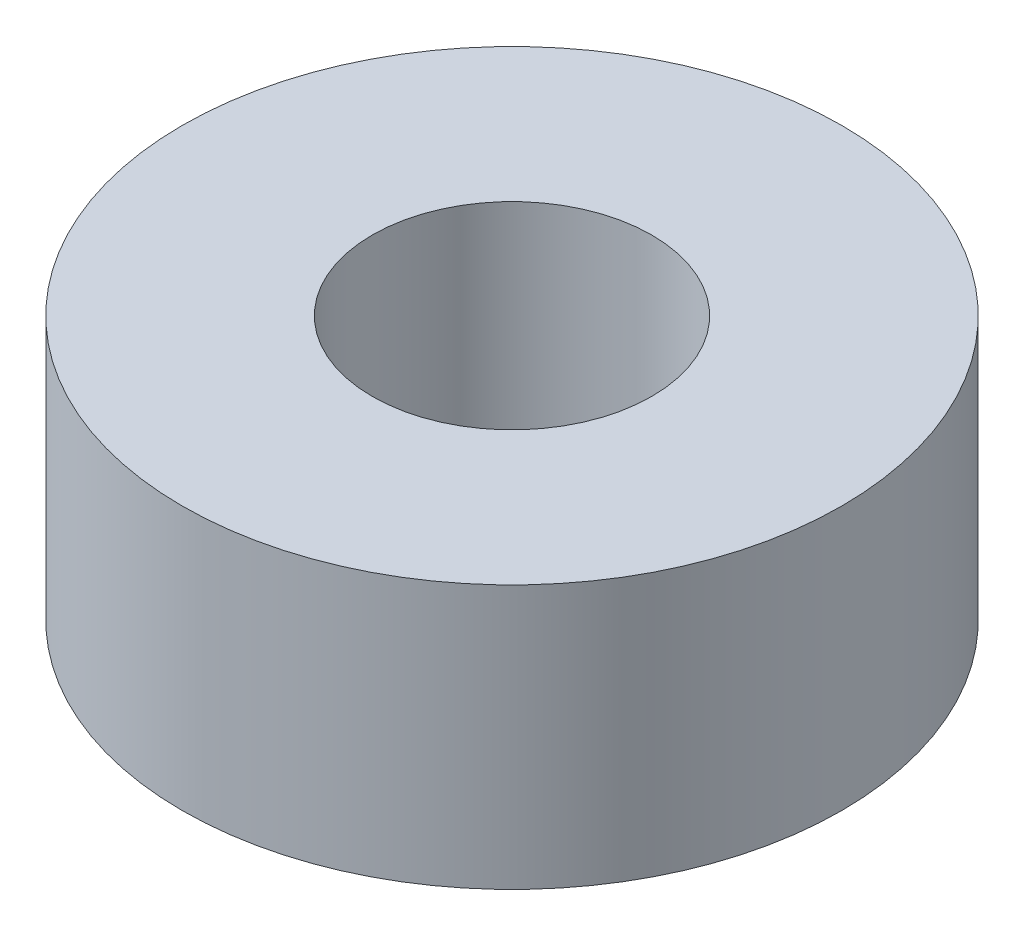
from build123d import *

# Parameters (mm, degrees)
SKETCH1_R           = 7.9375
SKETCH1_R_2         = 3.3655
BOSS_EXTRUDE1_DEPTH = 6.35


with BuildPart() as part:
    # Sketch1 → Boss-Extrude1 (new body)
    with BuildSketch(Plane(origin=(0, 0, 0), x_dir=(1, 0, 0), z_dir=(0, 1, 0))):
        with Locations(Location((0, 0, 0), (0, 0, 270))):
            Circle(SKETCH1_R)
        with Locations(Location((0, 0, 0), (0, 0, 270))):
            Circle(SKETCH1_R_2, mode=Mode.SUBTRACT)
    extrude(amount=BOSS_EXTRUDE1_DEPTH)


solid = part.part
